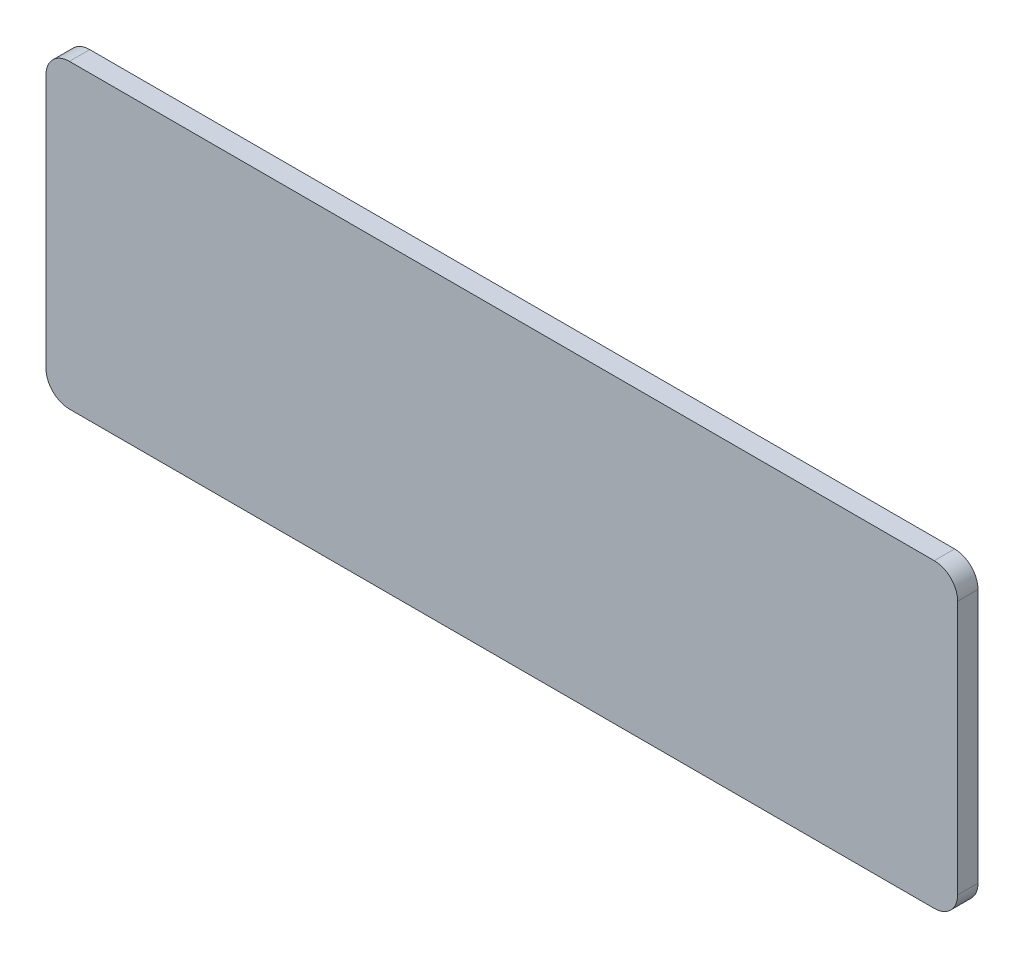
from build123d import *

# Parameters (mm, degrees)
BOSS_EXTRUDE1_DEPTH = 2.54


with BuildPart() as part:
    # Sketch2 → Boss-Extrude1 (new body)
    with BuildSketch(Plane.XY):
        with BuildLine():
            Line((123.063, 259.538949367), (15.113, 259.538949367))
            ThreePointArc((15.113, 259.538949367), (13.047541092, 258.683408274), (12.192, 256.617949367))
            Line((12.192, 256.617949367), (12.192, 224.867949367))
            ThreePointArc((12.192, 224.867949367), (13.047541092, 222.802490459), (15.113, 221.946949367))
            Line((15.113, 221.946949367), (123.063, 221.946949367))
            ThreePointArc((123.063, 221.946949367), (125.128458908, 222.802490459), (125.984, 224.867949367))
            Line((125.984, 224.867949367), (125.984, 256.617949367))
            ThreePointArc((125.984, 256.617949367), (125.128458908, 258.683408274), (123.063, 259.538949367))
        make_face()
    extrude(amount=BOSS_EXTRUDE1_DEPTH)


solid = part.part
